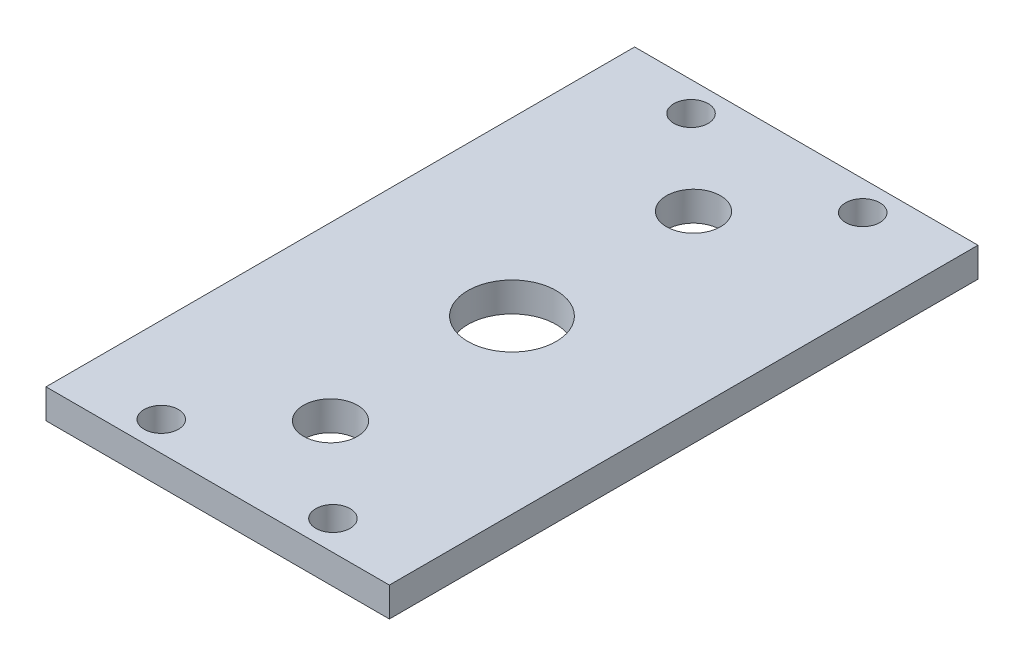
from build123d import *

# Parameters (mm, degrees)
SKETCH_1_W          = 35
SKETCH_1_H          = 60
EXTRUDE_1_DEPTH     = 3
HOLE_WIZARD_1_D     = 3.5
HOLE_WIZARD_2_D     = 5.5
SKETCH_8_R          = 4.5
CUT_EXTRUDE_1_DEPTH = 3


with BuildPart() as part:
    # 草图1 → 凸台-拉伸1 (new body)
    with BuildSketch(Plane(origin=(0, 0, 0), x_dir=(1, 0, 0), z_dir=(0, 1, 0))):
        Rectangle(SKETCH_1_W, SKETCH_1_H)
    extrude(amount=EXTRUDE_1_DEPTH)

    # 孔1 (through all)
    with Locations(Plane(origin=(0, 3, 0), x_dir=(1, 0, 0), z_dir=(0, 1, 0))):
        with Locations((-8.75, 27), (8.75, 27), (8.75, -27), (-8.75, -27)):
            Hole(HOLE_WIZARD_1_D / 2)

    # 孔2 (through all)
    with Locations(Plane(origin=(0, 3, 0), x_dir=(1, 0, 0), z_dir=(0, 1, 0))):
        with Locations((0, 18.5), (0, -18.5)):
            Hole(HOLE_WIZARD_2_D / 2)

    # 草图8 → 切除-拉伸1 (cut)
    with BuildSketch(Plane(origin=(0, 3, 0), x_dir=(1, 0, 0), z_dir=(0, 1, 0))):
        with Locations(Location((0, 0, 0), (0, 0, 270))):
            Circle(SKETCH_8_R)
    extrude(amount=-CUT_EXTRUDE_1_DEPTH, mode=Mode.SUBTRACT)


solid = part.part
